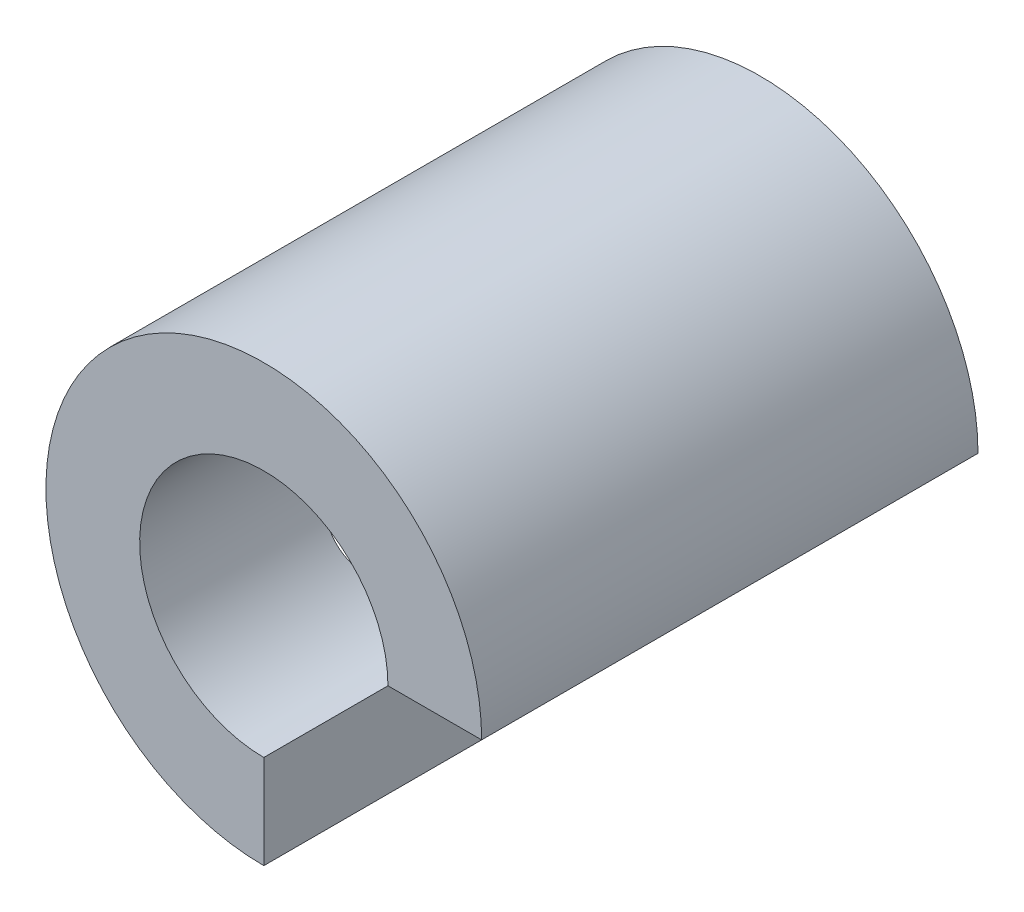
from build123d import *

# Parameters (mm, degrees)
BOSS_EXTRUDE1_DEPTH                 = 2.54
F_1_32_0_03125_DIAMETER_HOLE1_D     = 0.79375
F_1_32_0_03125_DIAMETER_HOLE1_DEPTH = 1.27
F_1_32_0_03125_DIAMETER_HOLE1_TIP   = 0.333017666


with BuildPart() as part:
    # Sketch1 → Boss-Extrude1 (new body)
    with BuildSketch(Plane.XY):
        with BuildLine():
            Line((0, -1.114963074), (0, -0.635351917))
            ThreePointArc((0, -0.635351917), (-0.449261649, 0.449261649), (0.635351917, 0))
            Line((0.635351917, 0), (1.114963074, 0))
            ThreePointArc((1.114963074, 0), (-0.78839795, 0.78839795), (0, -1.114963074))
        make_face()
    extrude(amount=BOSS_EXTRUDE1_DEPTH)

    # 1/32 (0.03125) Diameter Hole1
    with Locations(Plane(origin=(-0.929920595, -0.615134411, 1.266279726), x_dir=(0.551708325444, -0.834037123656, 0), z_dir=(-0.834037123656, -0.551708325444, 0))):
        with Locations((-1e-09, 0)):
            Hole(F_1_32_0_03125_DIAMETER_HOLE1_D / 2, depth=F_1_32_0_03125_DIAMETER_HOLE1_DEPTH)
            with Locations((0, 0, -(F_1_32_0_03125_DIAMETER_HOLE1_DEPTH + F_1_32_0_03125_DIAMETER_HOLE1_TIP / 2))):  # 100° drill point
                Cone(0, F_1_32_0_03125_DIAMETER_HOLE1_D / 2, F_1_32_0_03125_DIAMETER_HOLE1_TIP, mode=Mode.SUBTRACT)


solid = part.part
